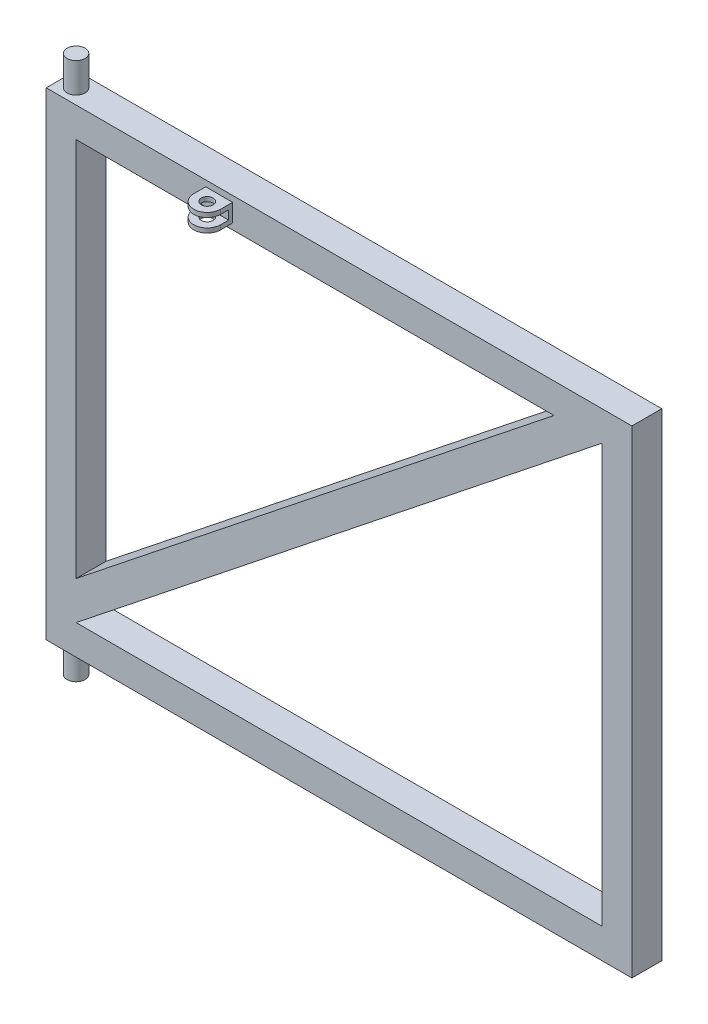
from build123d import *

# Parameters (mm, degrees)
ESQUISSE1_W             = 980
ESQUISSE1_H             = 800
BOSS_EXTRU_1_DEPTH      = 50
ESQUISSE2_R             = 15
BOSS_EXTRU_2_DEPTH      = 50
ESQUISSE3_R             = 15.180649449
BOSS_EXTRU_3_DEPTH      = 50
ESQUISSE4_R             = 10
BOSS_EXTRU_4_DEPTH      = 15
ESQUISSE5_W             = 76.670865877
ESQUISSE5_H             = 55.476162872
ENL_V_MAT_EXTRU_1_DEPTH = 7.5


with BuildPart() as part:
    # Esquisse1 → Boss.-Extru.1 (new body)
    with BuildSketch(Plane.XY):
        with Locations((490, -400)):
            Rectangle(ESQUISSE1_W, ESQUISSE1_H)
        Polygon((50, -50), (849.681755446, -50), (50, -686.110487287), align=None, mode=Mode.SUBTRACT)
        Polygon((930, -50), (930, -750), (50, -750), align=None, mode=Mode.SUBTRACT)
    extrude(amount=BOSS_EXTRU_1_DEPTH)

    # Esquisse2 → Boss.-Extru.2 (add)
    with BuildSketch(Plane(origin=(0, 0, 0), x_dir=(1, 0, 0), z_dir=(0, 1, 0))):
        with Locations(Location((25, -25, 0), (0, 0, 90))):
            Circle(ESQUISSE2_R)
    extrude(amount=BOSS_EXTRU_2_DEPTH)

    # Esquisse3 → Boss.-Extru.3 (add)
    with BuildSketch(Plane.XZ.offset(800)):
        with Locations(Location((25, 25, 0), (0, 0, 90))):
            Circle(ESQUISSE3_R)
    extrude(amount=BOSS_EXTRU_3_DEPTH)

    # Esquisse4 → Boss.-Extru.4 (add, symmetric)
    with BuildSketch(Plane(origin=(0, -25, 0), x_dir=(1, 0, 0), z_dir=(0, 1, 0))):
        with BuildLine():
            Line((311.828309325, -25.473135395), (266.828309325, -25.473135395))
            Line((266.828309325, -25.473135395), (266.828309325, -70))
            ThreePointArc((266.828309325, -70), (289.328309325, -92.5), (311.828309325, -70))
            Line((311.828309325, -70), (311.828309325, -25.473135395))
        make_face()
        with Locations(Location((289.328309325, -70, 0), (0, 0, 270))):
            Circle(ESQUISSE4_R, mode=Mode.SUBTRACT)
    extrude(amount=BOSS_EXTRU_4_DEPTH, both=True)

    # Esquisse5 → Enlèv. mat.-Extru.1 (cut, symmetric)
    with BuildSketch(Plane(origin=(0, -25, 0), x_dir=(1, 0, 0), z_dir=(0, 1, 0))):
        with Locations((288.67808852, -84.339373114)):
            Rectangle(ESQUISSE5_W, ESQUISSE5_H)
    extrude(amount=ENL_V_MAT_EXTRU_1_DEPTH, both=True, mode=Mode.SUBTRACT)


solid = part.part
